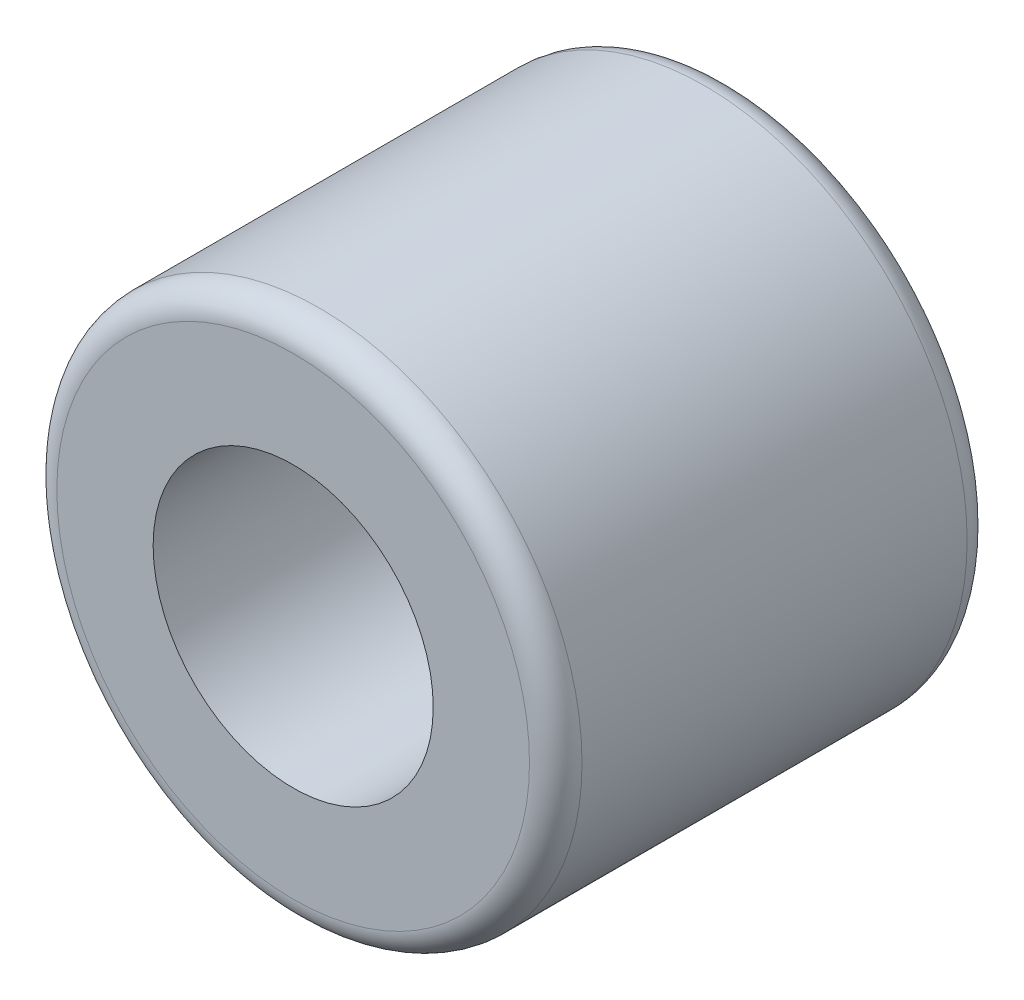
from build123d import *

# Parameters (mm, degrees)
SKETCH1_R           = 3
SKETCH1_R_2         = 1.6
BOSS_EXTRUDE1_DEPTH = 5
FILLET1_R           = 0.3


with BuildPart() as part:
    # Sketch1 → Boss-Extrude1 (new body)
    with BuildSketch(Plane.XY):
        Circle(SKETCH1_R)
        Circle(SKETCH1_R_2, mode=Mode.SUBTRACT)
    extrude(amount=BOSS_EXTRUDE1_DEPTH)

    # Fillet1
    fillet1_edges = [part.edges().sort_by_distance(p)[0] for p in [
        (-3, 0, 0),
        (-3, 0, 5),
    ]]
    fillet(fillet1_edges, radius=FILLET1_R)


solid = part.part
